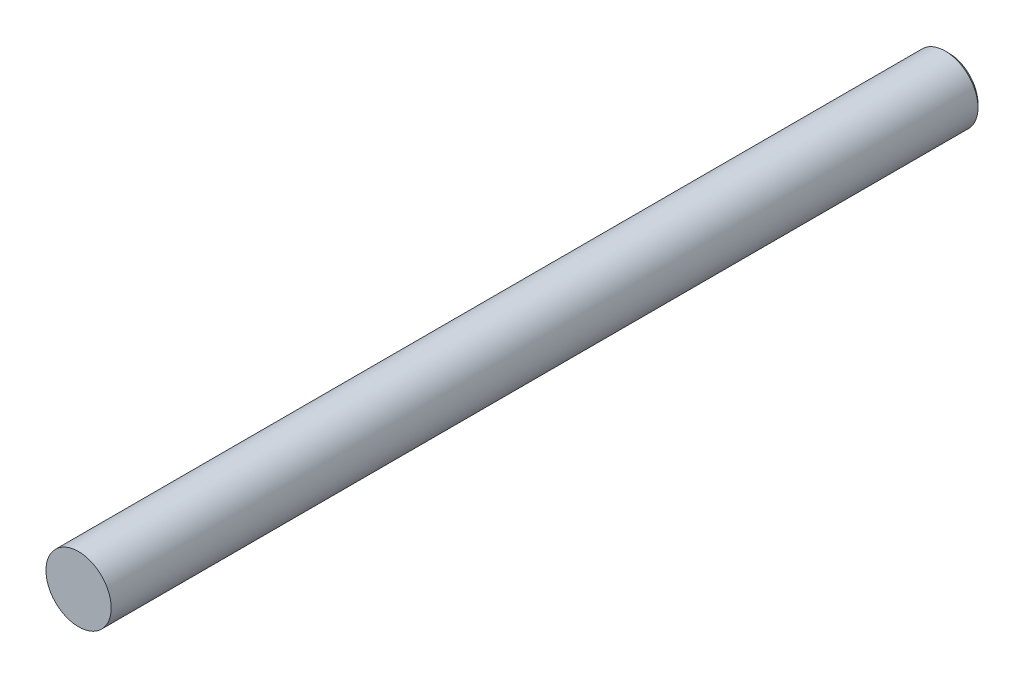
from build123d import *

# Parameters (mm, degrees)
SKETCH1_R           = 3
BOSS_EXTRUDE1_DEPTH = 40
CHAMFER1_SIZE       = 0.3


with BuildPart() as part:
    # Sketch1 → Boss-Extrude1 (new, symmetric)
    with BuildSketch(Plane.XY):
        Circle(SKETCH1_R)
    extrude(amount=BOSS_EXTRUDE1_DEPTH, both=True)

    # Chamfer1
    chamfer1_edges = [part.edges().sort_by_distance(p)[0] for p in [
        (-3, 0, -40),
    ]]
    chamfer(chamfer1_edges, length=CHAMFER1_SIZE)


solid = part.part
